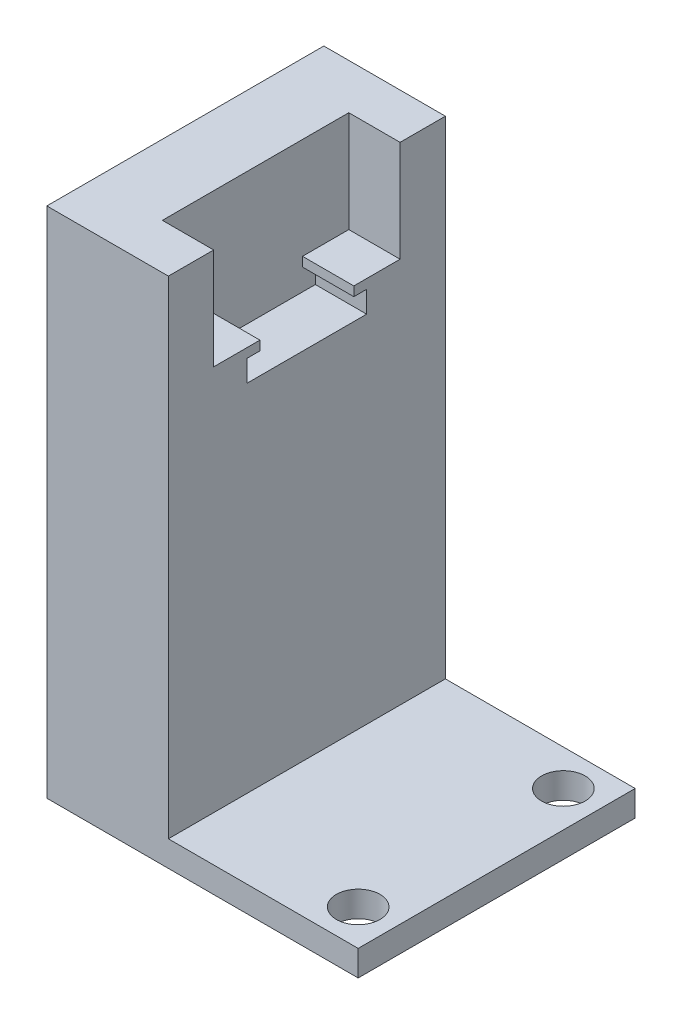
from build123d import *

# Parameters (mm, degrees)
SKETCH1_W            = 84.39
SKETCH1_H            = 54
SKETCH1_R            = 4.25
BOSS_EXTRUDE1_DEPTH  = 100
CUT_EXTRUDE1_DEPTH   = 10
SKETCH3_W            = 36.999403
SKETCH3_H            = 54
CUT_EXTRUDE2_DEPTH   = 95
MIRROR2_COPY_1_DEPTH = 10
CUT_EXTRUDE3_REACH   = 122.054
SKETCH4_W            = 141.405079451
SKETCH4_H            = 141.172887202


with BuildPart() as part:
    # Sketch1 → Boss-Extrude1 (new body)
    with BuildSketch(Plane(origin=(0, 0, 0), x_dir=(1, 0, 0), z_dir=(0, 1, 0))):
        Rectangle(SKETCH1_W, SKETCH1_H)
        with Locations(Location((35.195, 20, 0), (0, 0, 270))):
            Circle(SKETCH1_R, mode=Mode.SUBTRACT)
        with Locations(Location((35.195, -20, 0), (0, 0, 270))):
            Circle(SKETCH1_R, mode=Mode.SUBTRACT)
    extrude(amount=BOSS_EXTRUDE1_DEPTH)

    # Sketch2 → Cut-Extrude1 (cut)
    with BuildSketch(Plane.ZY.offset(42.195)):
        Polygon((-11.65, 78.45), (-9.15, 78.45), (-9.15, 80.267556596), (-18.171447478, 80.267556596), (-18.171447478, 100), (0, 100), (0, 74.25), (-11.65, 74.25), align=None)
    cut_extrude1 = extrude(amount=-CUT_EXTRUDE1_DEPTH, mode=Mode.SUBTRACT)

    # Sketch3 → Cut-Extrude2 (cut)
    with BuildSketch(Plane(origin=(0, 100, 0), x_dir=(1, 0, 0), z_dir=(0, 1, 0))):
        with Locations((23.6952985, 0)):
            Rectangle(SKETCH3_W, SKETCH3_H)
    extrude(amount=-CUT_EXTRUDE2_DEPTH, mode=Mode.SUBTRACT)

    # Mirror1: Cut-Extrude1 across plane
    add(cut_extrude1.mirror(Plane.XY), mode=Mode.SUBTRACT)

    # Mirror2: Cut-Extrude1 across plane
    add(cut_extrude1.mirror(Plane(origin=(-18.4997015, 0, 0), x_dir=(0, 0, 1), z_dir=(1, 0, 0))), mode=Mode.SUBTRACT)

    # Mirror2 copy 1 sketch → Mirror2 copy 1 (cut)
    with BuildSketch(Plane(origin=(5.195597, 0, 0), x_dir=(0, 0, -1), z_dir=(1, 0, 0))):
        Polygon((-11.65, 78.45), (-9.15, 78.45), (-9.15, 80.267556596), (-18.171447478, 80.267556596), (-18.171447478, 100), (0, 100), (0, 74.25), (-11.65, 74.25), align=None)
    extrude(amount=-MIRROR2_COPY_1_DEPTH, mode=Mode.SUBTRACT)

    # Sketch4 → Cut-Extrude3 (cut, up to next)
    with BuildSketch(Plane(origin=(-18.4997015, 0, 0), x_dir=(0, 0, -1), z_dir=(1, 0, 0)), mode=Mode.PRIVATE) as cut_extrude3_sk1:
        with Locations((22.522648123, 44.65957828)):
            Rectangle(SKETCH4_W, SKETCH4_H)
    cut_extrude3_tool1 = extrude(cut_extrude3_sk1.sketch, amount=-CUT_EXTRUDE3_REACH, mode=Mode.PRIVATE) & part.part
    add(cut_extrude3_tool1.solids().sort_by_distance((-18.499701, 44.659578, -22.522648))[0], mode=Mode.SUBTRACT)


solid = part.part
